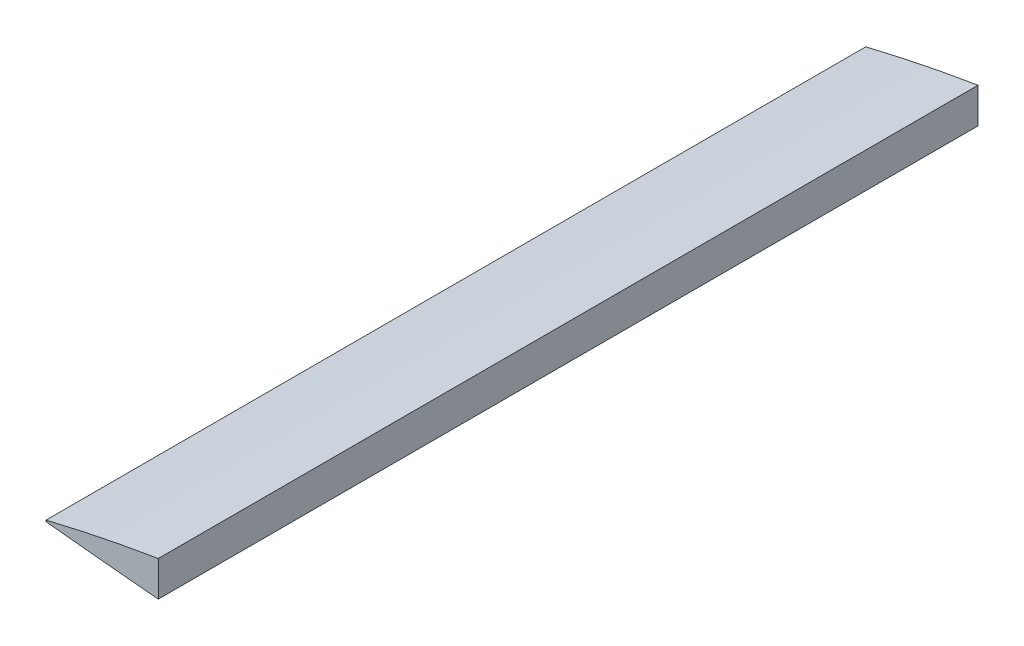
from build123d import *

# Parameters (mm, degrees)
BOSS_EXTRUDE1_DEPTH = 612
SKETCH2_W           = 21
SKETCH2_H           = 11.5
CUT_EXTRUDE1_DEPTH  = 13


with BuildPart() as part:
    # Sketch1 → Boss-Extrude1 (new body)
    with BuildSketch(Plane.XY):
        with BuildLine():
            Line((-238.52642, 17.587837008), (-238.52642, -8.716692608))
            add(Edge.make_bspline(
                [(-238.52642, -8.716692608), (-240.645712689, -8.524566336), (-246.278870054, -8.013887689), (-255.233473928, -7.18185892), (-265.178981162, -6.244995156), (-274.489440352, -5.352918296), (-283.105667881, -4.514534117), (-290.972478701, -3.737166797), (-298.039247243, -3.028597664), (-304.260184656, -2.395334726), (-309.594932864, -1.846814637), (-314.008232694, -1.382760705), (-317.472079994, -1.027677659), (-319.961203892, -0.741044399), (-321.464120443, -0.620061141), (-322.14198951, -0.505870173), (-322.321741193, -0.506509982), (-322.333, -0.506550056)],
                knots=[0, 0, 0, 0, 0.075810952, 0.201508279, 0.320388141, 0.43169539, 0.534719075, 0.628797147, 0.713321079, 0.787740393, 0.851567051, 0.904379655, 0.945827345, 0.975633259, 0.993597432, 0.999598973, 1, 1, 1, 1], degree=3))
            Line((-322.333, -0.506550056), (-322.333, 0.514797488))
            add(Edge.make_bspline(
                [(-238.52642, 17.587837008), (-240.97409295, 17.181883875), (-246.929768524, 16.194119087), (-256.181161896, 14.546071568), (-266.070660074, 12.709259674), (-275.306483123, 10.911648489), (-283.834265101, 9.183942037), (-291.603292923, 7.551124985), (-298.5678643, 6.038775613), (-304.687234381, 4.671057654), (-309.925850127, 3.470601465), (-314.253461718, 2.457844812), (-317.645235976, 1.650544322), (-320.081782459, 1.063070487), (-321.538022536, 0.709024901), (-322.180548986, 0.552044036), (-322.333, 0.514797488)],
                knots=[0, 0, 0, 0, 0.087007005, 0.211705365, 0.329527113, 0.439740645, 0.541660709, 0.634652346, 0.718134669, 0.791584505, 0.854539888, 0.906603358, 0.947445002, 0.976805146, 0.994496602, 1, 1, 1, 1], degree=3))
        make_face()
    extrude(amount=-BOSS_EXTRUDE1_DEPTH)

    # Sketch2 → Cut-Extrude1 (cut)
    with BuildSketch(Plane.XY.offset(-96.9)):
        with Locations((-251.75, -3.34)):
            Rectangle(SKETCH2_W, SKETCH2_H)
    extrude(amount=CUT_EXTRUDE1_DEPTH, mode=Mode.SUBTRACT)


solid = part.part
